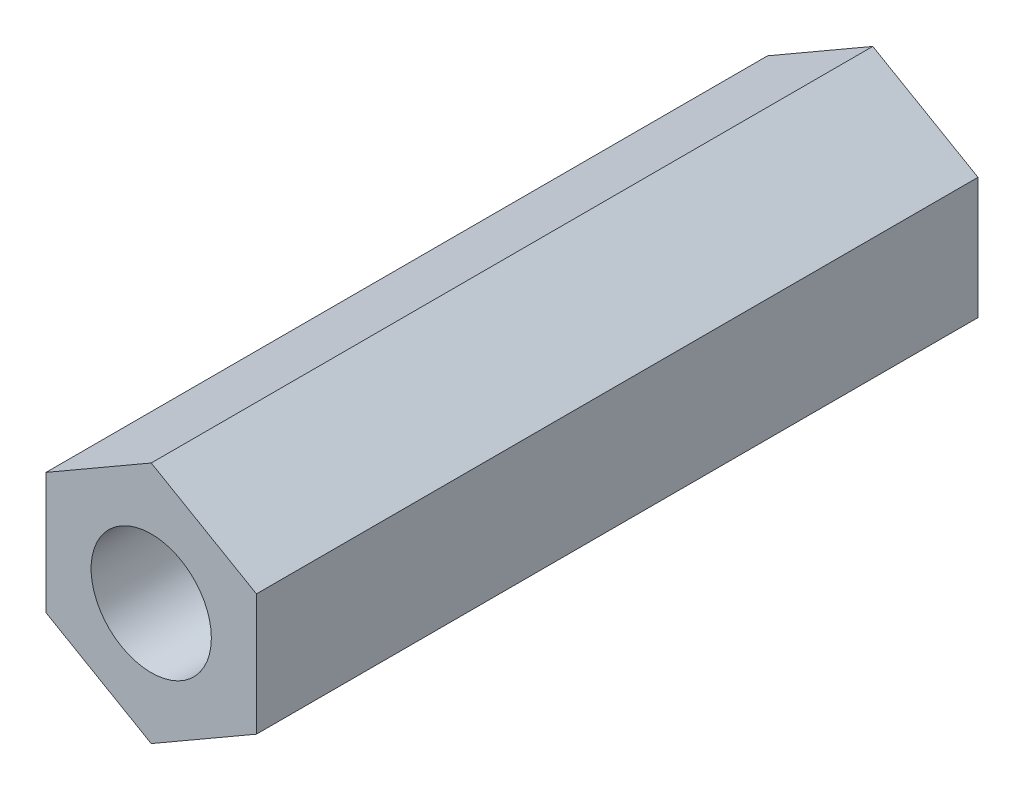
from build123d import *

# Parameters (mm, degrees)
ESTRUSIONE_ESTRUSIONE1_DEPTH = 24
SCHIZZO2_R                   = 2
TAGLIO_ESTRUSIONE1_DEPTH     = 25.588276339


with BuildPart() as part:
    # Schizzo1 → Estrusione-Estrusione1 (new body)
    with BuildSketch(Plane.XY):
        Polygon((0, 4.041451884), (-3.5, 2.020725942), (-3.5, -2.020725942), (0, -4.041451884), (3.5, -2.020725942), (3.5, 2.020725942), align=None)
    extrude(amount=ESTRUSIONE_ESTRUSIONE1_DEPTH)

    # Schizzo2 → Taglio-Estrusione1 (cut, through all)
    with BuildSketch(Plane.XY.offset(24)):
        Circle(SCHIZZO2_R)
    extrude(amount=-TAGLIO_ESTRUSIONE1_DEPTH, mode=Mode.SUBTRACT)


solid = part.part
